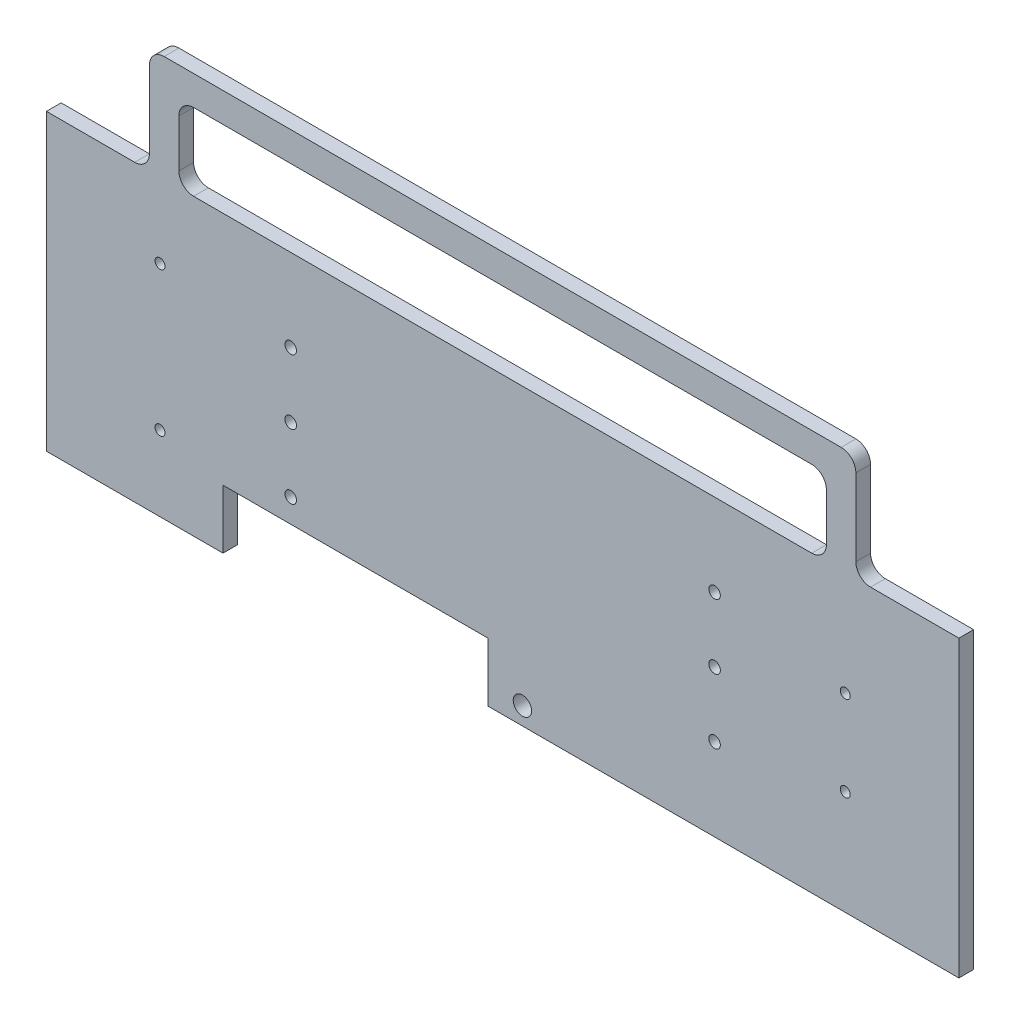
from build123d import *

# Parameters (mm, degrees)
SKETCH1_W                      = 393.7
SKETCH1_H                      = 127
BOSS_EXTRUDE1_DEPTH            = 6.35
F_10_CLEARANCE_HOLE1_D         = 4.9784
BOSS_EXTRUDE2_DEPTH            = 6.35
FILLET1_R                      = 6.35
F_8_CLEARANCE_HOLE1_D          = 4.3053
SKETCH11_W                     = 114.3
SKETCH11_H                     = 25.4
CUT_EXTRUDE1_DEPTH             = 226.28847424
F_5_16_0_3125_DIAMETER_HOLE1_D = 7.9375


with BuildPart() as part:
    # Sketch1 → Boss-Extrude1 (new body)
    with BuildSketch(Plane.XY):
        Rectangle(SKETCH1_W, SKETCH1_H)
    extrude(amount=BOSS_EXTRUDE1_DEPTH)

    # #10 Clearance Hole1 (through all)
    with Locations(Plane.XY.offset(6.35)):
        with Locations((-91.44, 27.94), (-91.44, -27.94), (91.44, 27.94), (91.44, -27.94), (-91.44, 0), (91.44, 0)):
            Hole(F_10_CLEARANCE_HOLE1_D / 2)

    # Sketch10 → Boss-Extrude2 (add)
    with BuildSketch(Plane.XY.offset(6.35)):
        Polygon((-152.4, 63.5), (-139.7, 63.5), (-139.7, 96.68304999), (139.7, 96.68304999), (139.7, 63.5), (152.4, 63.5), (152.4, 109.38304999), (-152.4, 109.38304999), align=None)
    extrude(amount=-BOSS_EXTRUDE2_DEPTH)

    # Fillet1
    fillet1_edges = [part.edges().sort_by_distance(p)[0] for p in [
        (152.4, 109.38304999, 3.175),
        (-152.4, 109.38304999, 3.175),
        (-152.4, 63.5, 3.175),
        (152.4, 63.5, 3.175),
        (139.7, 96.68304999, 3.175),
        (139.7, 63.5, 3.175),
        (-139.7, 63.5, 3.175),
        (-139.7, 96.68304999, 3.175),
    ]]
    fillet(fillet1_edges, radius=FILLET1_R)

    # #8 Clearance Hole1 (through all)
    with Locations(Plane.XY.offset(6.35)):
        with Locations((-147.828, 31.115), (-147.828, -31.115), (147.828, 18.415), (147.828, -18.415)):
            Hole(F_8_CLEARANCE_HOLE1_D / 2)

    # Sketch11 → Cut-Extrude1 (cut, through all)
    with BuildSketch(Plane.XY.offset(6.35)):
        with Locations((-63.5, -50.8)):
            Rectangle(SKETCH11_W, SKETCH11_H)
    extrude(amount=-CUT_EXTRUDE1_DEPTH, mode=Mode.SUBTRACT)

    # 5/16 (0.3125) Diameter Hole1 (through all)
    with Locations(Plane.XY.offset(6.35)):
        with Locations((8.534908, -55.88)):
            Hole(F_5_16_0_3125_DIAMETER_HOLE1_D / 2)


solid = part.part
